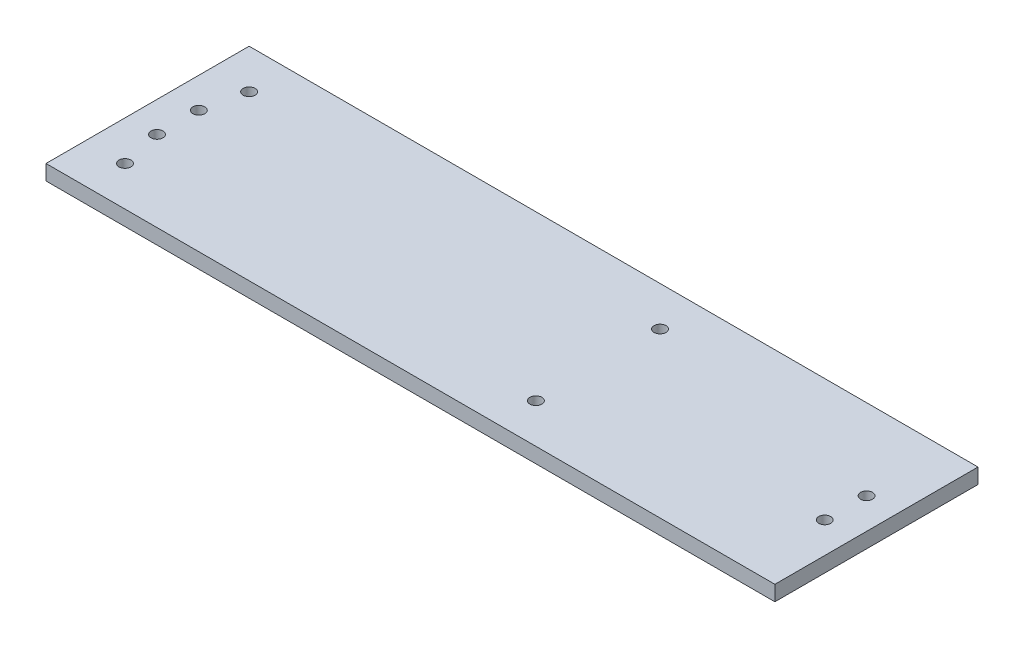
from build123d import *

# Parameters (mm, degrees)
SKETCH1_W               = 305
SKETCH1_H               = 85
BOSS_EXTRUDE1_DEPTH     = 3.175
SKETCH4_R               = 2.5
CUT_EXTRUDE2_DEPTH      = 161.752389174
CUT_EXTRUDE3_DEPTH      = 159.438702658
CUT_EXTRUDE3_DEPTH_BACK = 159.438702658
SKETCH6_R               = 2.5
CUT_EXTRUDE4_DEPTH      = 159.438702658
CUT_EXTRUDE4_DEPTH_BACK = 159.438702658
SKETCH7_R               = 2.5


with BuildPart() as part:
    # Sketch1 → Boss-Extrude1 (new, symmetric)
    with BuildSketch(Plane(origin=(0, 0, 0), x_dir=(1, 0, 0), z_dir=(0, 1, 0))):
        Rectangle(SKETCH1_W, SKETCH1_H)
    extrude(amount=BOSS_EXTRUDE1_DEPTH, both=True)

    # Sketch4 → Cut-Extrude2 (cut, symmetric)
    with BuildSketch(Plane(origin=(-2.5, 0, 0), x_dir=(-1, 0, 0), z_dir=(0, -1, 0))):
        with Locations(Location((133.48, -25.98, 0), (0, 0, 90))):
            Circle(SKETCH4_R)
        with Locations(Location((133.48, 25.98, 0), (0, 0, 270))):
            Circle(SKETCH4_R)
    cut_extrude2 = extrude(amount=CUT_EXTRUDE2_DEPTH, both=True, mode=Mode.SUBTRACT)

    # Mirror2: Cut-Extrude2 across plane
    add(cut_extrude2.mirror(Plane.ZY.offset(50)), mode=Mode.SUBTRACT)

    # Sketch6 → Cut-Extrude3 (cut, two sides: drawn at the far end of the back side and taken through both)
    with BuildSketch(Plane(origin=(0, 3.175, 0), x_dir=(1, 0, 0), z_dir=(0, 1, 0)).offset(-CUT_EXTRUDE3_DEPTH_BACK)):
        with Locations(Location((-139.8, 8.75, 0), (0, 0, 270))):
            Circle(SKETCH6_R)
        with Locations(Location((-139.8, -8.75, 0), (0, 0, 270))):
            Circle(SKETCH6_R)
    extrude(amount=CUT_EXTRUDE3_DEPTH + CUT_EXTRUDE3_DEPTH_BACK, mode=Mode.SUBTRACT)

    # Sketch7 → Cut-Extrude4 (cut, two sides: drawn at the far end of the back side and taken through both)
    with BuildSketch(Plane.XZ.offset(3.175).offset(-CUT_EXTRUDE4_DEPTH_BACK)):
        with Locations(Location((139.6, -8.75, 0), (0, 0, 270))):
            Circle(SKETCH7_R)
        with Locations(Location((139.6, 8.75, 0), (0, 0, 270))):
            Circle(SKETCH7_R)
    extrude(amount=CUT_EXTRUDE4_DEPTH + CUT_EXTRUDE4_DEPTH_BACK, mode=Mode.SUBTRACT)


solid = part.part
